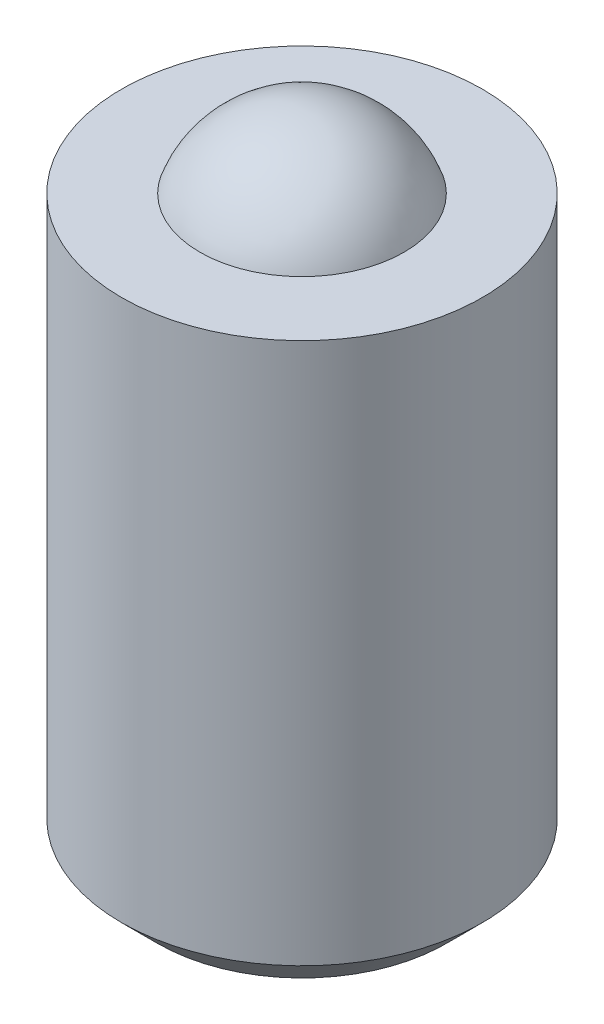
from build123d import *


with BuildPart() as part:
    # 草图1 → 旋转1 (revolve)
    with BuildSketch(Plane(origin=(0, 0, 0), x_dir=(0, 0, -1), z_dir=(1, 0, 0))):
        with BuildLine():
            Line((-2.828427125, 0), (-5, 0))
            Line((-5, 0), (-5, -15))
            Line((-5, -15), (-4, -16))
            Line((-4, -16), (0, -16))
            Line((0, -16), (0, 2))
            ThreePointArc((0, 2), (-1.732050808, 1.449489743), (-2.828427125, 0))
        make_face()
    revolve(axis=Axis((0, 46.298402486, 0), (0, -1, 0)))


solid = part.part
